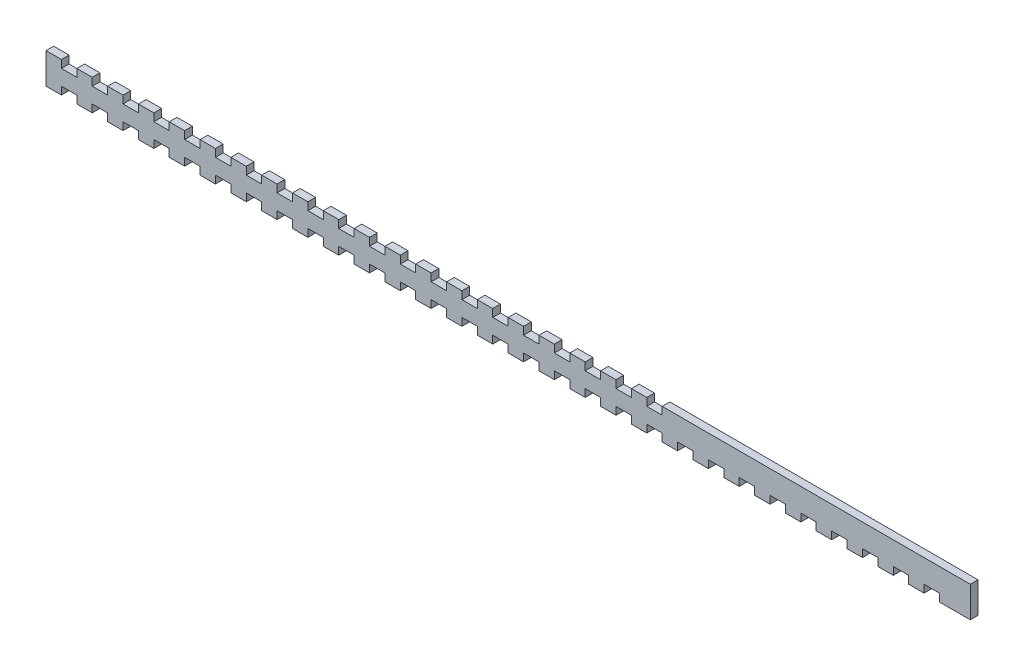
from build123d import *

# Parameters (mm, degrees)
BOSS_EXTRU_1_DEPTH      = 5
ESQUISSE3_W             = 10
ESQUISSE3_H             = 5
ENL_V_MAT_EXTRU_1_DEPTH = 301.208261046


with BuildPart() as part:
    # Esquisse1 → Boss.-Extru.1 (new body)
    with BuildSketch(Plane.XY):
        Polygon((-300, 10), (200, 10), (300, 10), (300, -10), (-300, -10), align=None)
    extrude(amount=BOSS_EXTRU_1_DEPTH)

    # Esquisse3 → Enlèv. mat.-Extru.1 (cut, through all)
    with BuildSketch(Plane.XY.offset(5)):
        with Locations((-285, -7.5)):
            Rectangle(ESQUISSE3_W, ESQUISSE3_H)
        with Locations((-265, -7.5)):
            Rectangle(ESQUISSE3_W, ESQUISSE3_H)
        with Locations((-245, -7.5)):
            Rectangle(ESQUISSE3_W, ESQUISSE3_H)
        with Locations((-225, -7.5)):
            Rectangle(ESQUISSE3_W, ESQUISSE3_H)
        with Locations((-205, -7.5)):
            Rectangle(ESQUISSE3_W, ESQUISSE3_H)
        with Locations((-185, -7.5)):
            Rectangle(ESQUISSE3_W, ESQUISSE3_H)
        with Locations((-165, -7.5)):
            Rectangle(ESQUISSE3_W, ESQUISSE3_H)
        with Locations((-145, -7.5)):
            Rectangle(ESQUISSE3_W, ESQUISSE3_H)
        with Locations((-125, -7.5)):
            Rectangle(ESQUISSE3_W, ESQUISSE3_H)
        with Locations((-105, -7.5)):
            Rectangle(ESQUISSE3_W, ESQUISSE3_H)
        with Locations((-85, -7.5)):
            Rectangle(ESQUISSE3_W, ESQUISSE3_H)
        with Locations((-65, -7.5)):
            Rectangle(ESQUISSE3_W, ESQUISSE3_H)
        with Locations((-45, -7.5)):
            Rectangle(ESQUISSE3_W, ESQUISSE3_H)
        with Locations((-25, -7.5)):
            Rectangle(ESQUISSE3_W, ESQUISSE3_H)
        with Locations((-5, -7.5)):
            Rectangle(ESQUISSE3_W, ESQUISSE3_H)
        with Locations((15, -7.5)):
            Rectangle(ESQUISSE3_W, ESQUISSE3_H)
        with Locations((35, -7.5)):
            Rectangle(ESQUISSE3_W, ESQUISSE3_H)
        with Locations((55, -7.5)):
            Rectangle(ESQUISSE3_W, ESQUISSE3_H)
        with Locations((75, -7.5)):
            Rectangle(ESQUISSE3_W, ESQUISSE3_H)
        with Locations((95, -7.5)):
            Rectangle(ESQUISSE3_W, ESQUISSE3_H)
        with Locations((115, -7.5)):
            Rectangle(ESQUISSE3_W, ESQUISSE3_H)
        with Locations((135, -7.5)):
            Rectangle(ESQUISSE3_W, ESQUISSE3_H)
        with Locations((155, -7.5)):
            Rectangle(ESQUISSE3_W, ESQUISSE3_H)
        with Locations((175, -7.5)):
            Rectangle(ESQUISSE3_W, ESQUISSE3_H)
        with Locations((195, -7.5)):
            Rectangle(ESQUISSE3_W, ESQUISSE3_H)
        with Locations((215, -7.5)):
            Rectangle(ESQUISSE3_W, ESQUISSE3_H)
        with Locations((235, -7.5)):
            Rectangle(ESQUISSE3_W, ESQUISSE3_H)
        with Locations((255, -7.5)):
            Rectangle(ESQUISSE3_W, ESQUISSE3_H)
        with Locations((275, -7.5)):
            Rectangle(ESQUISSE3_W, ESQUISSE3_H)
        with Locations((-285, 7.5)):
            Rectangle(ESQUISSE3_W, ESQUISSE3_H)
        with Locations((-265, 7.5)):
            Rectangle(ESQUISSE3_W, ESQUISSE3_H)
        with Locations((-245, 7.5)):
            Rectangle(ESQUISSE3_W, ESQUISSE3_H)
        with Locations((-225, 7.5)):
            Rectangle(ESQUISSE3_W, ESQUISSE3_H)
        with Locations((-205, 7.5)):
            Rectangle(ESQUISSE3_W, ESQUISSE3_H)
        with Locations((-185, 7.5)):
            Rectangle(ESQUISSE3_W, ESQUISSE3_H)
        with Locations((-165, 7.5)):
            Rectangle(ESQUISSE3_W, ESQUISSE3_H)
        with Locations((-145, 7.5)):
            Rectangle(ESQUISSE3_W, ESQUISSE3_H)
        with Locations((-125, 7.5)):
            Rectangle(ESQUISSE3_W, ESQUISSE3_H)
        with Locations((-105, 7.5)):
            Rectangle(ESQUISSE3_W, ESQUISSE3_H)
        with Locations((-85, 7.5)):
            Rectangle(ESQUISSE3_W, ESQUISSE3_H)
        with Locations((-65, 7.5)):
            Rectangle(ESQUISSE3_W, ESQUISSE3_H)
        with Locations((-45, 7.5)):
            Rectangle(ESQUISSE3_W, ESQUISSE3_H)
        with Locations((-25, 7.5)):
            Rectangle(ESQUISSE3_W, ESQUISSE3_H)
        with Locations((-5, 7.5)):
            Rectangle(ESQUISSE3_W, ESQUISSE3_H)
        with Locations((15, 7.5)):
            Rectangle(ESQUISSE3_W, ESQUISSE3_H)
        with Locations((35, 7.5)):
            Rectangle(ESQUISSE3_W, ESQUISSE3_H)
        with Locations((55, 7.5)):
            Rectangle(ESQUISSE3_W, ESQUISSE3_H)
        with Locations((75, 7.5)):
            Rectangle(ESQUISSE3_W, ESQUISSE3_H)
        with Locations((95, 7.5)):
            Rectangle(ESQUISSE3_W, ESQUISSE3_H)
    extrude(amount=-ENL_V_MAT_EXTRU_1_DEPTH, mode=Mode.SUBTRACT)


solid = part.part
